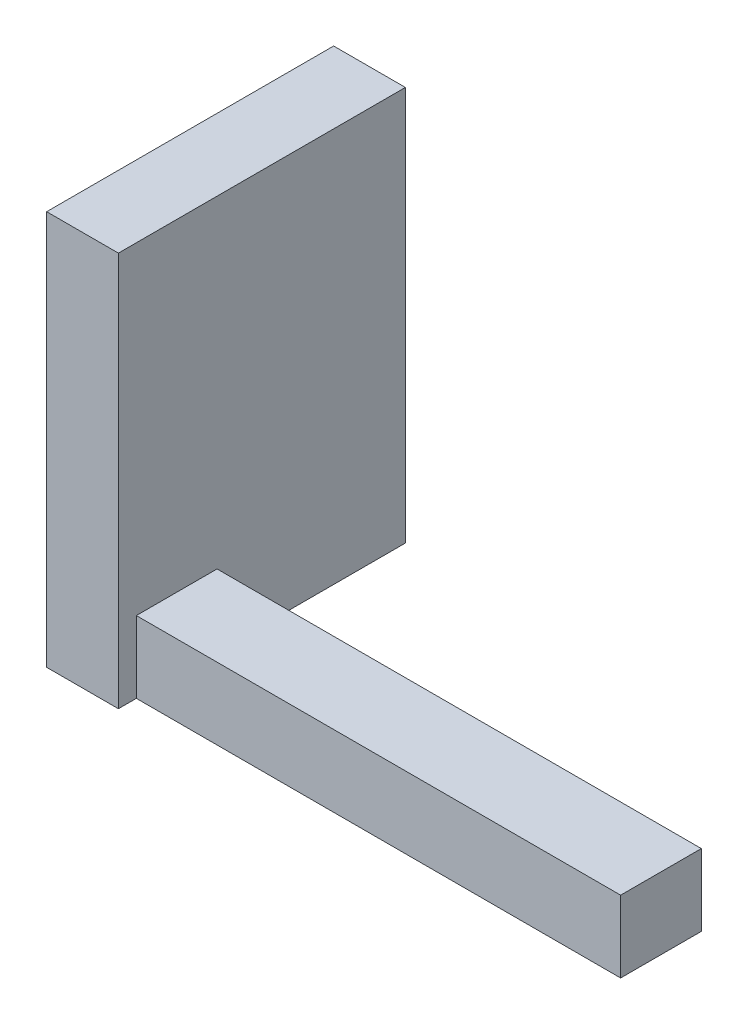
from build123d import *

# Parameters (mm, degrees)
COLUMN_START       = 46
SKETCH1_W          = 16
SKETCH1_H          = 22
COLUMN_DEPTH       = 4
ANCHOR_PLATE_START = 46
SKETCH2_W          = 4.5
SKETCH2_H          = 4
ANCHOR_PLATE_DEPTH = 31


with BuildPart() as part:
    # Sketch1 → column (new body)
    with BuildSketch(Plane(origin=(0, 0, 0), x_dir=(0, 0, -1), z_dir=(1, 0, 0)).offset(COLUMN_START)):
        with Locations((-32, 77)):
            Rectangle(SKETCH1_W, SKETCH1_H)
    extrude(amount=COLUMN_DEPTH)


with BuildPart() as body_2:
    # Sketch2 → anchor_plate (new body)
    with BuildSketch(Plane(origin=(0, 0, 0), x_dir=(0, 0, -1), z_dir=(1, 0, 0)).offset(ANCHOR_PLATE_START)):
        with Locations((-36.75, 68)):
            Rectangle(SKETCH2_W, SKETCH2_H)
    extrude(amount=ANCHOR_PLATE_DEPTH)


solid = Compound([part.part, body_2.part])
